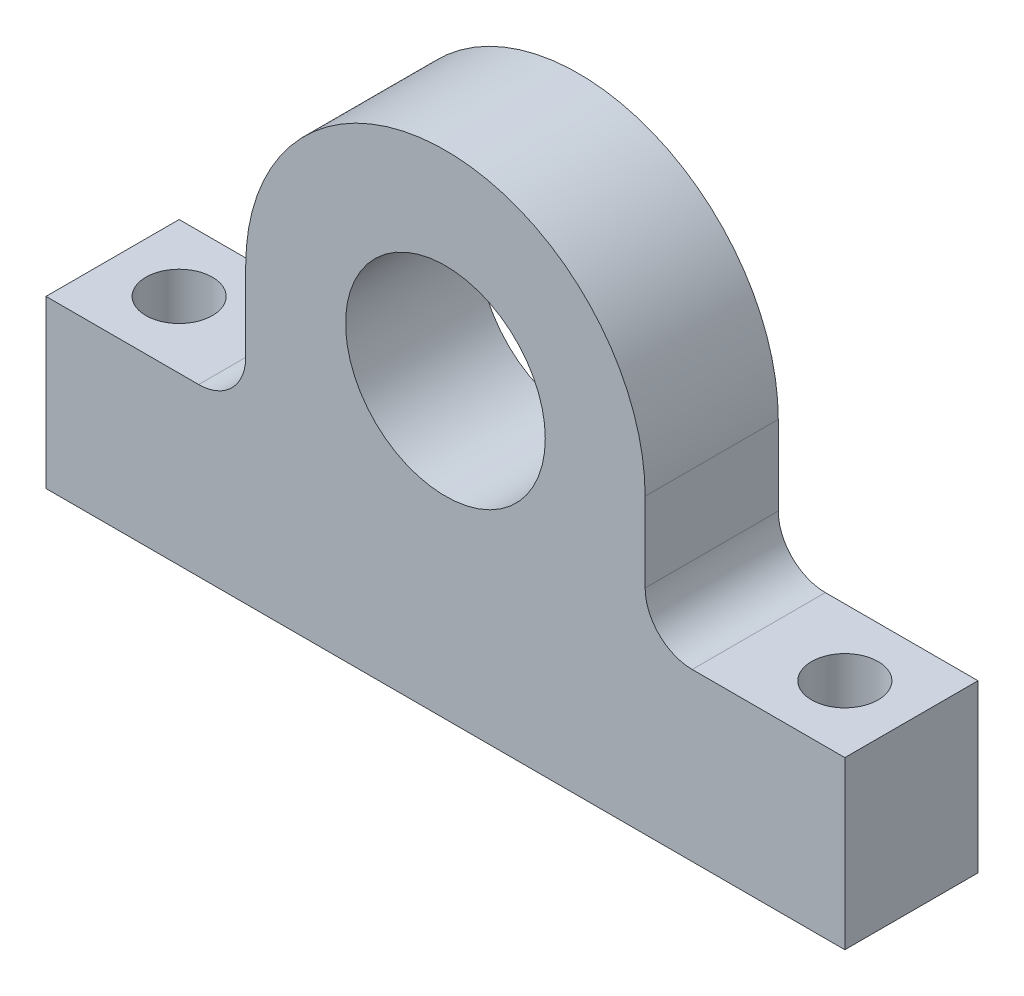
from build123d import *
from build123d.topology import SkipClean

# Parameters (mm, degrees)
SKETCH1_R           = 7.5
BOSS_EXTRUDE2_DEPTH = 10
SKETCH2_R           = 2.5
CUT_EXTRUDE1_DEPTH  = 10
SKETCH3_W           = 60
SKETCH3_H           = 10
SKETCH3_R           = 2.5
BOSS_EXTRUDE3_DEPTH = 7.5


with BuildPart() as part:
    # Sketch1 → Boss-Extrude2 (new body)
    with BuildSketch(Plane.XY):
        with BuildLine():
            Line((-15, -1.464466094), (-15, 4.5))
            ThreePointArc((-15, 4.5), (0, 19.5), (15, 4.5))
            Line((15, 4.5), (15, -1.464466094))
            ThreePointArc((15, -1.464466094), (16.035533906, -3.964466094), (18.535533906, -5))
            Line((18.535533906, -5), (30, -5))
            Line((30, -5), (30, -10))
            Line((30, -10), (20, -10))
            Line((20, -10), (0, -10))
            Line((0, -10), (-20, -10))
            Line((-20, -10), (-30, -10))
            Line((-30, -10), (-30, -5))
            Line((-30, -5), (-18.535533906, -5))
            ThreePointArc((-18.535533906, -5), (-16.035533906, -3.964466094), (-15, -1.464466094))
        make_face()
        with Locations((0, 4.5)):
            Circle(SKETCH1_R, mode=Mode.SUBTRACT)
    extrude(amount=BOSS_EXTRUDE2_DEPTH)

    # Sketch2 → Cut-Extrude1 (cut)
    with BuildSketch(Plane(origin=(0, -5, 0), x_dir=(1, 0, 0), z_dir=(0, 1, 0))):
        with Locations(Location((-25, -5, 0), (0, 0, 270))):
            Circle(SKETCH2_R)
        with Locations(Location((25, -5, 0), (0, 0, 270))):
            Circle(SKETCH2_R)
    extrude(amount=-CUT_EXTRUDE1_DEPTH, mode=Mode.SUBTRACT)

    # Sketch3 → Boss-Extrude3 (add)
    with SkipClean():  # the faces are left unmerged after this step: merging them gives an invalid solid
        with BuildSketch(Plane.XZ.offset(10)):
            with Locations((0, 5)):
                Rectangle(SKETCH3_W, SKETCH3_H)
            with Locations(Location((-25, 5, 0), (0, 0, 90))):
                Circle(SKETCH3_R, mode=Mode.SUBTRACT)
            with Locations(Location((25, 5, 0), (0, 0, 270))):
                Circle(SKETCH3_R, mode=Mode.SUBTRACT)
        extrude(amount=BOSS_EXTRUDE3_DEPTH)


solid = part.part
